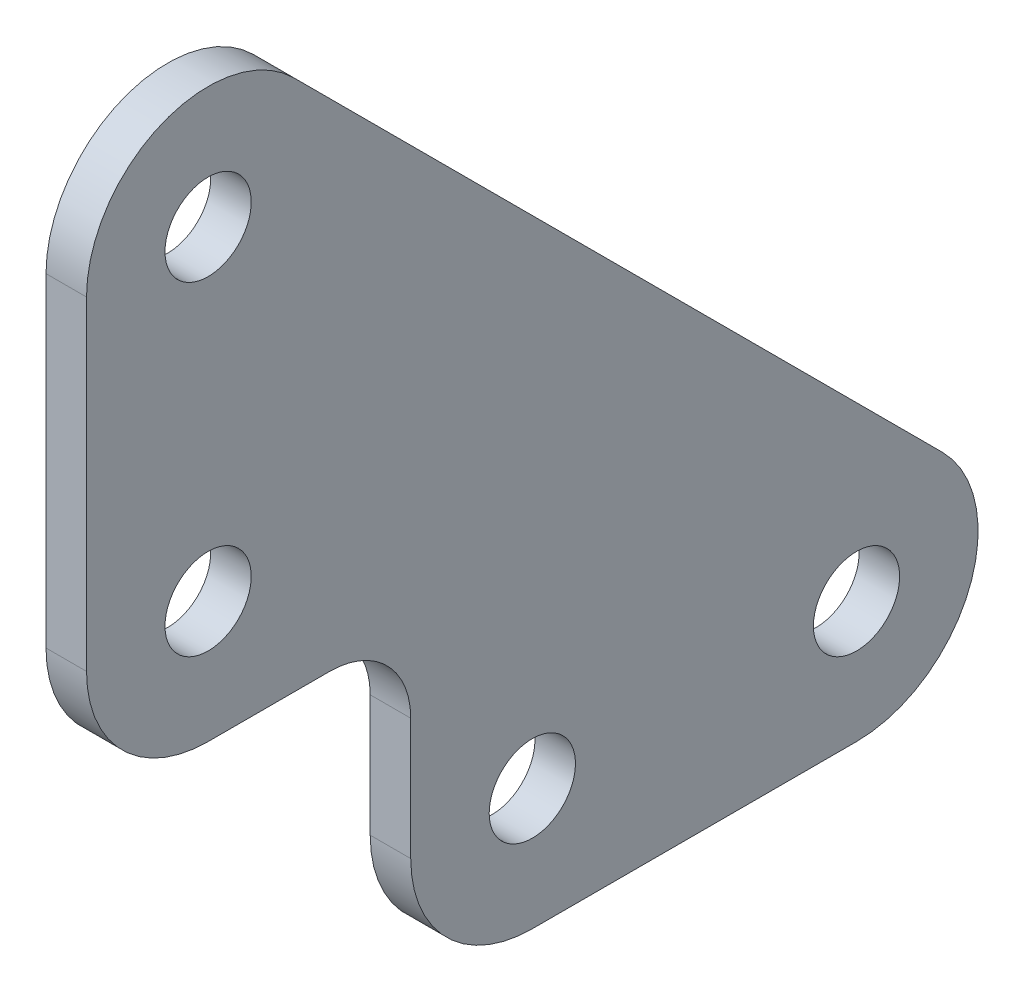
from build123d import *

# Parameters (mm, degrees)
BOSS_EXTRUDE1_START     = 92.868812
BOSS_EXTRUDE1_DEPTH     = 3.175
F_1_4_CLEARANCE_HOLE1_D = 6.7564
FILLET1_R               = 6.35


with BuildPart() as part:
    # Sketch1 → Boss-Extrude1 (new body)
    with BuildSketch(Plane(origin=(0, 0, 0), x_dir=(0, 0, -1), z_dir=(1, 0, 0)).offset(BOSS_EXTRUDE1_START)):
        with BuildLine():
            Line((-1321.740142063, 202.439766645), (-1270.940142063, 151.639766645))
            ThreePointArc((-1270.940142063, 151.639766645), (-1268.875381607, 141.259514861), (-1277.675334154, 135.379574554))
            Line((-1277.675334154, 135.379574554), (-1303.075334154, 135.379574554))
            ThreePointArc((-1303.075334154, 135.379574554), (-1309.810526245, 138.169382463), (-1312.600334154, 144.904574554))
            Line((-1312.600334154, 144.904574554), (-1312.600334154, 160.779574554))
            Line((-1312.600334154, 160.779574554), (-1328.475334154, 160.779574554))
            ThreePointArc((-1328.475334154, 160.779574554), (-1335.210526245, 163.569382463), (-1338.000334154, 170.304574554))
            Line((-1338.000334154, 170.304574554), (-1338.000334154, 195.704574554))
            ThreePointArc((-1338.000334154, 195.704574554), (-1332.120393847, 204.504527101), (-1321.740142063, 202.439766645))
        make_face()
    extrude(amount=BOSS_EXTRUDE1_DEPTH)

    # 1/4 Clearance Hole1 (through all)
    with Locations(Plane.ZY.offset(-92.868812484)):
        with Locations((1328.475334154, 195.704574554), (1328.475334154, 170.304574554), (1277.675334154, 144.904574554), (1303.075334154, 144.904574554)):
            Hole(F_1_4_CLEARANCE_HOLE1_D / 2)

    # Fillet1
    fillet1_edges = [part.edges().sort_by_distance(p)[0] for p in [
        (94.456312, 160.779574554, 1312.600334154),
    ]]
    fillet(fillet1_edges, radius=FILLET1_R)


solid = part.part
